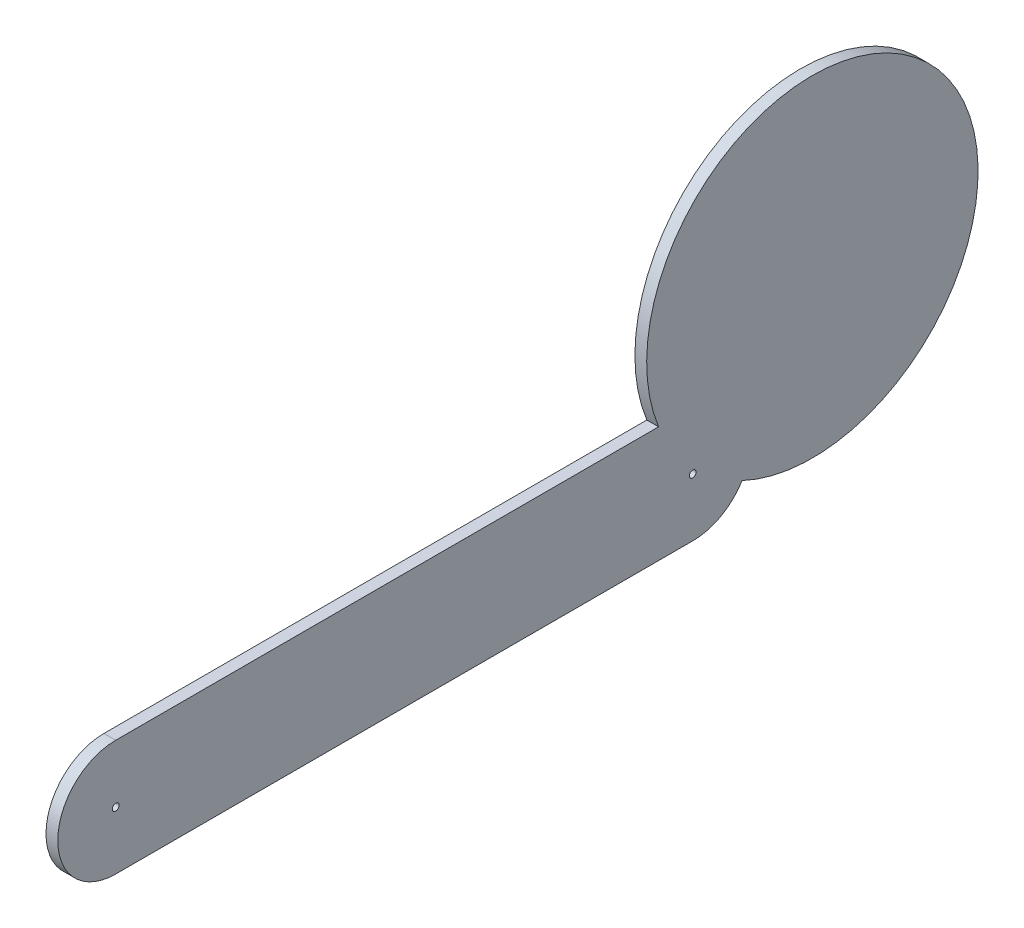
from build123d import *

# Parameters (mm, degrees)
SKETCH1_R           = 1.4732
BOSS_EXTRUDE1_DEPTH = 5.08
SKETCH2_R           = 71.5
BOSS_EXTRUDE2_DEPTH = 5.08


with BuildPart() as part:
    # Sketch1 → Boss-Extrude1 (new body)
    with BuildSketch(Plane(origin=(0, 0, 0), x_dir=(0, 0, -1), z_dir=(1, 0, 0))):
        with BuildLine():
            Line((-134.851685393, 37.21011236), (114.148314607, 37.21011236))
            ThreePointArc((114.148314607, 37.21011236), (139.148314607, 12.21011236), (114.148314607, -12.78988764))
            Line((114.148314607, -12.78988764), (-134.851685393, -12.78988764))
            ThreePointArc((-134.851685393, -12.78988764), (-159.851685393, 12.21011236), (-134.851685393, 37.21011236))
        make_face()
        with Locations((-134.851685393, 12.21011236)):
            Circle(SKETCH1_R, mode=Mode.SUBTRACT)
        with Locations((114.148314607, 12.21011236)):
            Circle(SKETCH1_R, mode=Mode.SUBTRACT)
    extrude(amount=BOSS_EXTRUDE1_DEPTH)

    # Sketch2 → Boss-Extrude2 (add)
    with BuildSketch(Plane(origin=(5.08, 0, 0), x_dir=(0, 0, -1), z_dir=(1, 0, 0))):
        with Locations((165.767109633, 63.828907386)):
            Circle(SKETCH2_R)
    extrude(amount=-BOSS_EXTRUDE2_DEPTH)


solid = part.part
